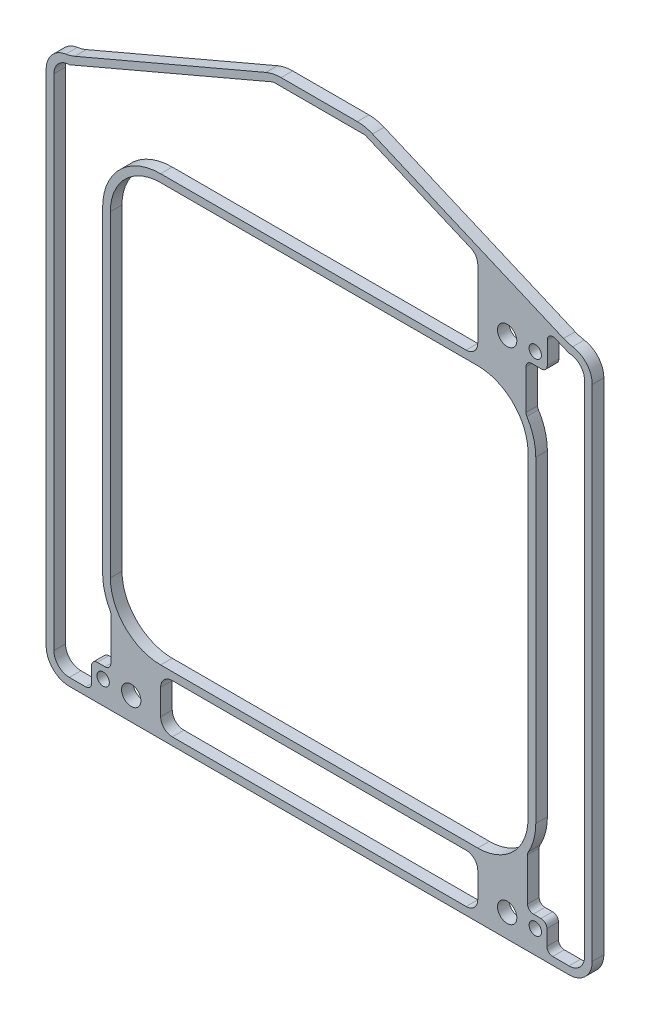
from build123d import *

# Parameters (mm, degrees)
SKETCH2_R           = 1.6
SKETCH2_R_2         = 2.5
SKETCH2_W           = 82
SKETCH2_H           = 12.6
BOSS_EXTRUDE1_DEPTH = 3
FILLET2_R           = 1.5
FILLET3_R           = 3


with BuildPart() as part:
    # Sketch2 → Boss-Extrude1 (new body)
    # profile 1 of 2: a face of its own
    with BuildSketch(Plane.XY):
        with BuildLine():
            ThreePointArc((-65.540902989, 70.525765905), (-69.163190657, 68.495804286), (-70.6, 64.6))
            Line((-70.6, 64.6), (-70.6, -64.6))
            ThreePointArc((-70.6, -64.6), (-68.842640687, -68.842640687), (-64.6, -70.6))
            Line((-64.6, -70.6), (64.6, -70.6))
            ThreePointArc((64.6, -70.6), (68.842640687, -68.842640687), (70.6, -64.6))
            Line((70.6, -64.6), (70.6, 64.6))
            ThreePointArc((70.6, 64.6), (69.163190657, 68.495804286), (65.540902989, 70.525765905))
            ThreePointArc((65.540902989, 70.525765905), (64.340790015, 70.792848887), (63.182522555, 71.205184867))
            Line((63.182522555, 71.205184867), (13.781138102, 92.296857547))
            ThreePointArc((13.781138102, 92.296857547), (11.858510235, 92.897157125), (9.854586018, 93.1))
            Line((9.854586018, 93.1), (-9.854586018, 93.1))
            ThreePointArc((-9.854586018, 93.1), (-11.858510235, 92.897157125), (-13.781138102, 92.296857547))
            Line((-13.781138102, 92.296857547), (-63.182522555, 71.205184867))
            ThreePointArc((-63.182522555, 71.205184867), (-64.340790015, 70.792848887), (-65.540902989, 70.525765905))
        make_face()
        with Locations((-55.87, -64.6)):
            Circle(SKETCH2_R, mode=Mode.SUBTRACT)
        with Locations((-48.6, -64.6)):
            Circle(SKETCH2_R_2, mode=Mode.SUBTRACT)
        with BuildLine():
            Line((-11.9, 91.1), (-6, 91.1))
            Line((-6, 91.1), (6, 91.1))
            Line((6, 91.1), (11.9, 91.1))
            Line((11.9, 91.1), (41, 78.675901328))
            Line((41, 78.675901328), (41, 56))
            Line((41, 56), (-41, 56))
            ThreePointArc((-41, 56), (-51.606601718, 51.606601718), (-56, 41))
            Line((-56, 41), (-56, -41))
            ThreePointArc((-56, -41), (-55.457696912, -44.996873778), (-53.87, -48.704745291))
            Line((-53.87, -48.704745291), (-53.87, -61.6))
            Line((-53.87, -61.6), (-58.87, -61.6))
            Line((-58.87, -61.6), (-58.87, -68.6))
            Line((-58.87, -68.6), (-64.6, -68.6))
            ThreePointArc((-64.6, -68.6), (-67.428427125, -67.428427125), (-68.6, -64.6))
            Line((-68.6, -64.6), (-68.6, 64.6))
            ThreePointArc((-68.6, 64.6), (-67.428427125, 67.428427125), (-64.6, 68.6))
            Line((-64.6, 68.6), (-11.9, 91.1))
        make_face(mode=Mode.SUBTRACT)
        with Locations((0, -62.3)):
            Rectangle(SKETCH2_W, SKETCH2_H, mode=Mode.SUBTRACT)
        with Locations((48.6, -64.6)):
            Circle(SKETCH2_R_2, mode=Mode.SUBTRACT)
        with Locations((55.87, -64.6)):
            Circle(SKETCH2_R, mode=Mode.SUBTRACT)
        with BuildLine():
            Line((41, -54), (-41, -54))
            ThreePointArc((-41, -54), (-50.192388155, -50.192388155), (-54, -41))
            Line((-54, -41), (-54, 41))
            ThreePointArc((-54, 41), (-50.192388155, 50.192388155), (-41, 54))
            Line((-41, 54), (41, 54))
            ThreePointArc((41, 54), (50.192388155, 50.192388155), (54, 41))
            Line((54, 41), (54, -41))
            ThreePointArc((54, -41), (50.192388155, -50.192388155), (41, -54))
        make_face(mode=Mode.SUBTRACT)
        with BuildLine():
            Line((58.972044185, 61.502827435), (58.972044185, 71.002827435))
            Line((58.972044185, 71.002827435), (64.6, 68.6))
            ThreePointArc((64.6, 68.6), (67.428427125, 67.428427125), (68.6, 64.6))
            Line((68.6, 64.6), (68.6, -64.6))
            ThreePointArc((68.6, -64.6), (67.428427125, -67.428427125), (64.6, -68.6))
            Line((64.6, -68.6), (58.87, -68.6))
            Line((58.87, -68.6), (58.87, -61.6))
            Line((58.87, -61.6), (53.87, -61.6))
            Line((53.87, -61.6), (53.87, -48.704745291))
            ThreePointArc((53.87, -48.704745291), (55.457696912, -44.996873778), (56, -41))
            Line((56, -41), (56, 41))
            ThreePointArc((56, 41), (55.354105036, 45.354270159), (53.472044185, 49.333553495))
            Line((53.472044185, 49.333553495), (53.472044185, 61.502827435))
            Line((53.472044185, 61.502827435), (58.972044185, 61.502827435))
        make_face(mode=Mode.SUBTRACT)
        with Locations((48.6, 64.6)):
            Circle(SKETCH2_R_2, mode=Mode.SUBTRACT)
        with Locations((55.87, 64.6)):
            Circle(SKETCH2_R, mode=Mode.SUBTRACT)
    # profile 2 of 2: a face of its own
    with BuildSketch(Plane.XY):
        with BuildLine():
            ThreePointArc((-65.540902989, 70.525765905), (-69.163190657, 68.495804286), (-70.6, 64.6))
            Line((-70.6, 64.6), (-70.6, -64.6))
            ThreePointArc((-70.6, -64.6), (-68.842640687, -68.842640687), (-64.6, -70.6))
            Line((-64.6, -70.6), (64.6, -70.6))
            ThreePointArc((64.6, -70.6), (68.842640687, -68.842640687), (70.6, -64.6))
            Line((70.6, -64.6), (70.6, 64.6))
            ThreePointArc((70.6, 64.6), (69.163190657, 68.495804286), (65.540902989, 70.525765905))
            ThreePointArc((65.540902989, 70.525765905), (64.340790015, 70.792848887), (63.182522555, 71.205184867))
            Line((63.182522555, 71.205184867), (13.781138102, 92.296857547))
            ThreePointArc((13.781138102, 92.296857547), (11.858510235, 92.897157125), (9.854586018, 93.1))
            Line((9.854586018, 93.1), (-9.854586018, 93.1))
            ThreePointArc((-9.854586018, 93.1), (-11.858510235, 92.897157125), (-13.781138102, 92.296857547))
            Line((-13.781138102, 92.296857547), (-63.182522555, 71.205184867))
            ThreePointArc((-63.182522555, 71.205184867), (-64.340790015, 70.792848887), (-65.540902989, 70.525765905))
        make_face()
        with Locations((-55.87, -64.6)):
            Circle(SKETCH2_R, mode=Mode.SUBTRACT)
        with Locations((-48.6, -64.6)):
            Circle(SKETCH2_R_2, mode=Mode.SUBTRACT)
        with BuildLine():
            Line((-11.9, 91.1), (-6, 91.1))
            Line((-6, 91.1), (6, 91.1))
            Line((6, 91.1), (11.9, 91.1))
            Line((11.9, 91.1), (41, 78.675901328))
            Line((41, 78.675901328), (41, 56))
            Line((41, 56), (-41, 56))
            ThreePointArc((-41, 56), (-51.606601718, 51.606601718), (-56, 41))
            Line((-56, 41), (-56, -41))
            ThreePointArc((-56, -41), (-55.457696912, -44.996873778), (-53.87, -48.704745291))
            Line((-53.87, -48.704745291), (-53.87, -61.6))
            Line((-53.87, -61.6), (-58.87, -61.6))
            Line((-58.87, -61.6), (-58.87, -68.6))
            Line((-58.87, -68.6), (-64.6, -68.6))
            ThreePointArc((-64.6, -68.6), (-67.428427125, -67.428427125), (-68.6, -64.6))
            Line((-68.6, -64.6), (-68.6, 64.6))
            ThreePointArc((-68.6, 64.6), (-67.428427125, 67.428427125), (-64.6, 68.6))
            Line((-64.6, 68.6), (-11.9, 91.1))
        make_face(mode=Mode.SUBTRACT)
        with Locations((0, -62.3)):
            Rectangle(SKETCH2_W, SKETCH2_H, mode=Mode.SUBTRACT)
        with Locations((48.6, -64.6)):
            Circle(SKETCH2_R_2, mode=Mode.SUBTRACT)
        with Locations((55.87, -64.6)):
            Circle(SKETCH2_R, mode=Mode.SUBTRACT)
        with BuildLine():
            Line((41, -54), (-41, -54))
            ThreePointArc((-41, -54), (-50.192388155, -50.192388155), (-54, -41))
            Line((-54, -41), (-54, 41))
            ThreePointArc((-54, 41), (-50.192388155, 50.192388155), (-41, 54))
            Line((-41, 54), (41, 54))
            ThreePointArc((41, 54), (50.192388155, 50.192388155), (54, 41))
            Line((54, 41), (54, -41))
            ThreePointArc((54, -41), (50.192388155, -50.192388155), (41, -54))
        make_face(mode=Mode.SUBTRACT)
        with BuildLine():
            Line((58.972044185, 61.502827435), (58.972044185, 71.002827435))
            Line((58.972044185, 71.002827435), (64.6, 68.6))
            ThreePointArc((64.6, 68.6), (67.428427125, 67.428427125), (68.6, 64.6))
            Line((68.6, 64.6), (68.6, -64.6))
            ThreePointArc((68.6, -64.6), (67.428427125, -67.428427125), (64.6, -68.6))
            Line((64.6, -68.6), (58.87, -68.6))
            Line((58.87, -68.6), (58.87, -61.6))
            Line((58.87, -61.6), (53.87, -61.6))
            Line((53.87, -61.6), (53.87, -48.704745291))
            ThreePointArc((53.87, -48.704745291), (55.457696912, -44.996873778), (56, -41))
            Line((56, -41), (56, 41))
            ThreePointArc((56, 41), (55.354105036, 45.354270159), (53.472044185, 49.333553495))
            Line((53.472044185, 49.333553495), (53.472044185, 61.502827435))
            Line((53.472044185, 61.502827435), (58.972044185, 61.502827435))
        make_face(mode=Mode.SUBTRACT)
        with Locations((48.6, 64.6)):
            Circle(SKETCH2_R_2, mode=Mode.SUBTRACT)
        with Locations((55.87, 64.6)):
            Circle(SKETCH2_R, mode=Mode.SUBTRACT)
    extrude(amount=BOSS_EXTRUDE1_DEPTH)

    # Fillet2
    fillet2_edges = [part.edges().sort_by_distance(p)[0] for p in [
        (58.972044185, 71.002827435, 1.5),
        (58.972044185, 61.502827435, 1.5),
        (53.472044185, 61.502827435, 1.5),
        (53.472044185, 49.333553495, 1.5),
        (53.87, -48.704745291, 1.5),
        (53.87, -61.6, 1.5),
        (58.87, -61.6, 1.5),
        (58.87, -68.6, 1.5),
        (-58.87, -68.6, 1.5),
        (-58.87, -61.6, 1.5),
        (-53.87, -61.6, 1.5),
        (-53.87, -48.704745291, 1.5),
    ]]
    fillet(fillet2_edges, radius=FILLET2_R)

    # Fillet3
    fillet3_edges = [part.edges().sort_by_distance(p)[0] for p in [
        (-41, -68.6, 1.5),
        (41, -68.6, 1.5),
        (41, -56, 1.5),
        (-41, -56, 1.5),
        (41, 56, 1.5),
        (41, 78.675901328, 1.5),
    ]]
    fillet(fillet3_edges, radius=FILLET3_R)


solid = part.part
